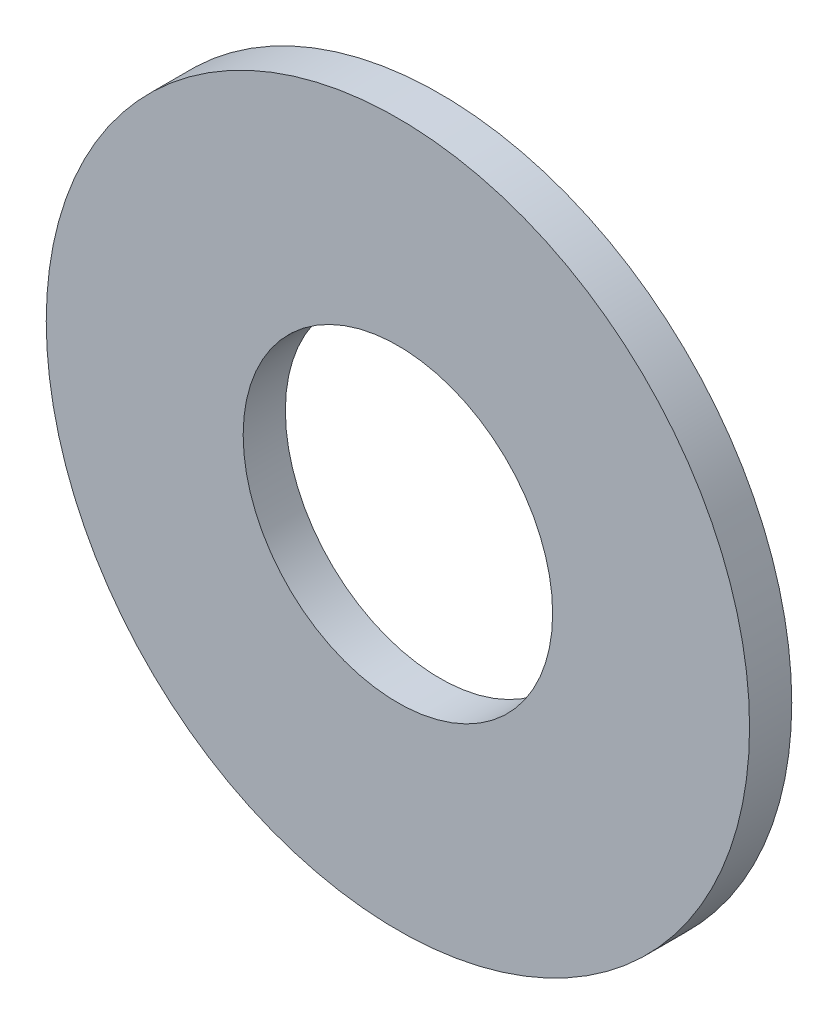
from build123d import *

# Parameters (mm, degrees)
SKETCH1_R             = 2.5
SKETCH1_R_2           = 1.1
WASHER_ENVELOPE_DEPTH = 0.3


with BuildPart() as part:
    # Sketch1 → Washer_Envelope (new body)
    with BuildSketch(Plane.XY):
        Circle(SKETCH1_R)
        Circle(SKETCH1_R_2, mode=Mode.SUBTRACT)
    extrude(amount=WASHER_ENVELOPE_DEPTH)


solid = part.part
